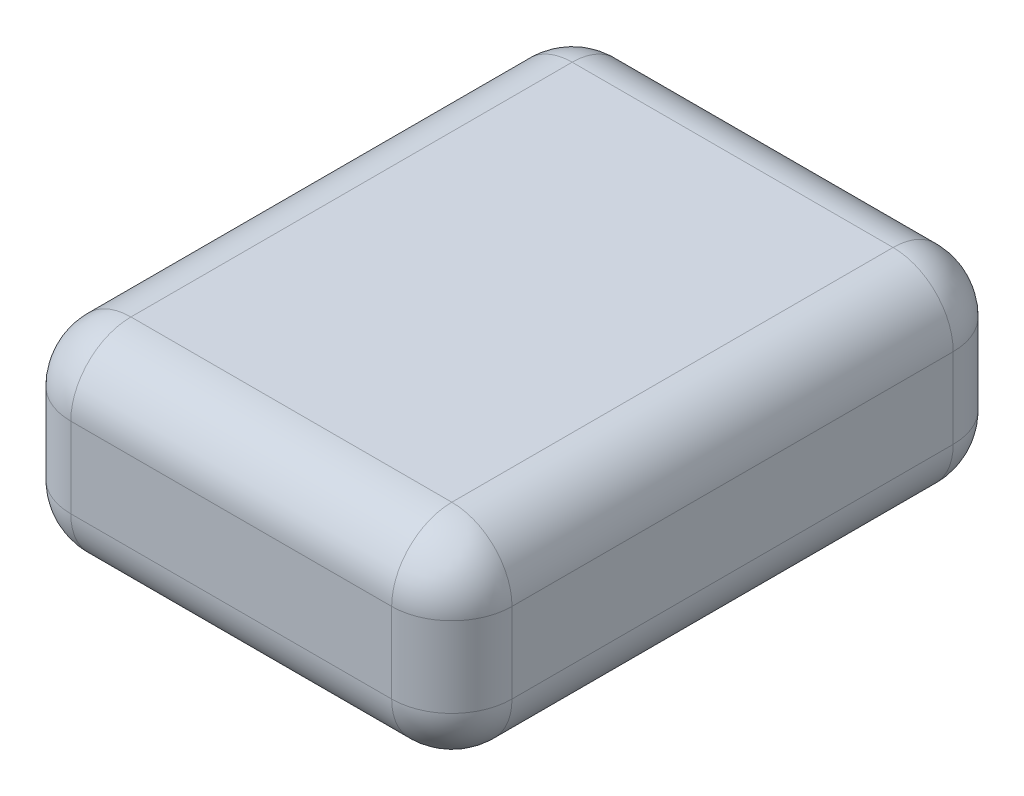
from build123d import *

# Parameters (mm, degrees)
SKETCH_1_W      = 22
SKETCH_1_H      = 28
EXTRUDE_1_DEPTH = 10
FILLET_1_R      = 3


with BuildPart() as part:
    # 草图1 → 凸台-拉伸1 (new body)
    with BuildSketch(Plane(origin=(0, 0, 0), x_dir=(1, 0, 0), z_dir=(0, 1, 0))):
        Rectangle(SKETCH_1_W, SKETCH_1_H)
    extrude(amount=EXTRUDE_1_DEPTH)

    # 圆角1
    fillet_1_edges = [part.edges().sort_by_distance(p)[0] for p in [
        (-11, 10, 0),
        (0, 10, 14),
        (11, 10, 0),
        (0, 0, 14),
        (-11, 0, 0),
        (0, 0, -14),
        (11, 0, 0),
        (11, 5, 14),
        (-11, 5, 14),
        (-11, 5, -14),
        (11, 5, -14),
        (0, 10, -14),
    ]]
    fillet(fillet_1_edges, radius=FILLET_1_R)


solid = part.part
